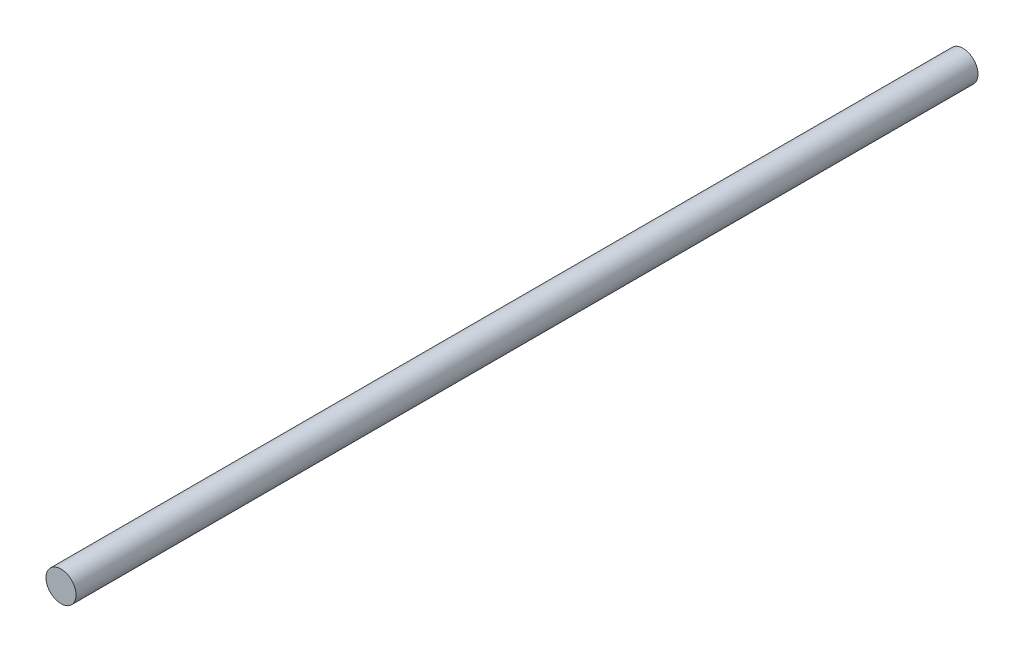
from build123d import *

# Parameters (mm, degrees)
SKETCH1_R           = 10
BOSS_EXTRUDE1_DEPTH = 600


with BuildPart() as part:
    # Sketch1 → Boss-Extrude1 (new body)
    with BuildSketch(Plane.XY):
        Circle(SKETCH1_R)
    extrude(amount=BOSS_EXTRUDE1_DEPTH)


solid = part.part
